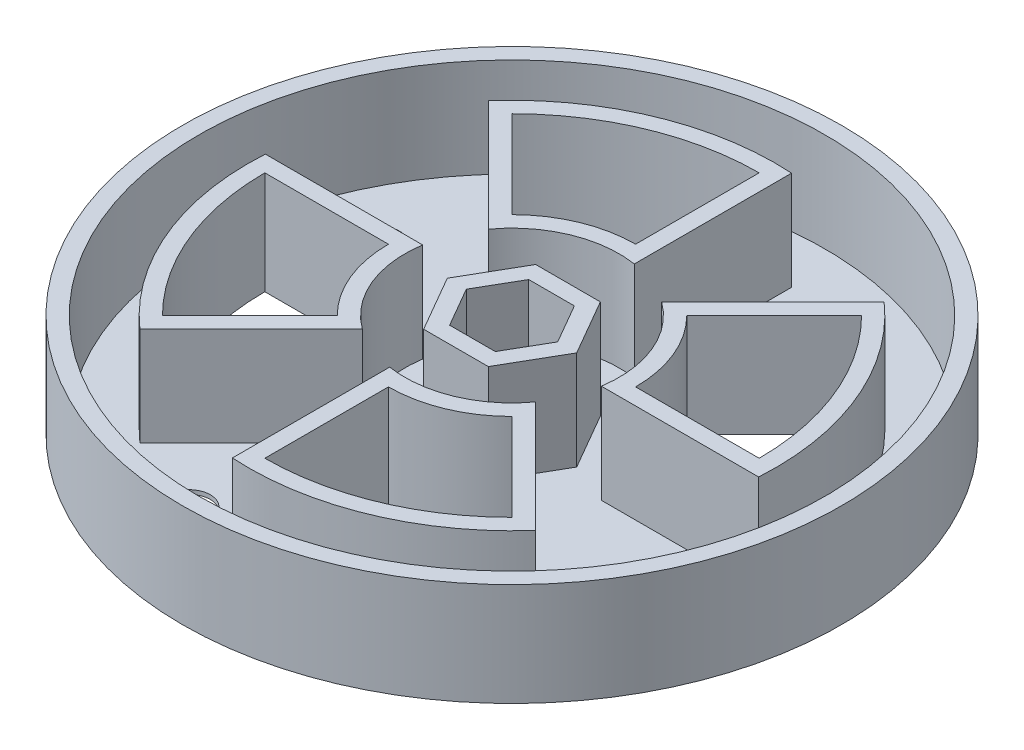
from build123d import *

# Parameters (mm, degrees)
SKETCH1_R           = 50.8
BOSS_EXTRUDE1_DEPTH = 15.875
CUT_EXTRUDE2_DEPTH  = 15.24
SKETCH5_R           = 4.191
CUT_EXTRUDE3_DEPTH  = 74.440708058
CUT_EXTRUDE4_DEPTH  = 74.575101937
SKETCH7_R           = 48.26
CUT_EXTRUDE5_DEPTH  = 15.24
SKETCH8_R           = 3.2639
CUT_EXTRUDE6_DEPTH  = 74.575101937


with BuildPart() as part:
    # Sketch1 → Boss-Extrude1 (new body)
    with BuildSketch(Plane(origin=(0, 0, 0), x_dir=(1, 0, 0), z_dir=(0, 1, 0))):
        with Locations(Location((0, 0, 0), (0, 0, 270))):
            Circle(SKETCH1_R)
    extrude(amount=BOSS_EXTRUDE1_DEPTH)

    # Sketch4 → Cut-Extrude2 (cut)
    with BuildSketch(Plane(origin=(0, 15.875, 0), x_dir=(1, 0, 0), z_dir=(0, 1, 0))):
        Polygon((-3.519527241, 6.096), (3.519527241, 6.096), (7.039054482, 0), (3.519527241, -6.096), (-3.519527241, -6.096), (-7.039054482, 0), align=None)
    extrude(amount=-CUT_EXTRUDE2_DEPTH, mode=Mode.SUBTRACT)

    # Sketch5 → Cut-Extrude3 (cut, through all)
    with BuildSketch(Plane(origin=(0, 0.635, 0), x_dir=(1, 0, 0), z_dir=(0, 1, 0))):
        with Locations(Location((0, 0, 0), (0, 0, 270))):
            Circle(SKETCH5_R)
    extrude(amount=-CUT_EXTRUDE3_DEPTH, mode=Mode.SUBTRACT)

    # Sketch6 → Cut-Extrude4 (cut, through all)
    with BuildSketch(Plane(origin=(0, 15.875, 0), x_dir=(1, 0, 0), z_dir=(0, 1, 0))):
        with BuildLine():
            ThreePointArc((-13.470384182, 13.470384182), (-7.290119387, 17.599905094), (0, 19.05))
            Line((0, 19.05), (0, 38.1))
            ThreePointArc((0, 38.1), (-14.580238773, 35.199810189), (-26.940768363, 26.940768363))
            Line((-26.940768363, 26.940768363), (-13.470384182, 13.470384182))
        make_face()
        with BuildLine():
            Line((26.940768363, 26.940768363), (13.470384182, 13.470384182))
            ThreePointArc((13.470384182, 13.470384182), (17.599905094, 7.290119387), (19.05, 0))
            Line((19.05, 0), (38.1, 0))
            ThreePointArc((38.1, 0), (35.199810189, 14.580238773), (26.940768363, 26.940768363))
        make_face()
        with BuildLine():
            Line((26.940768363, -26.940768363), (13.470384182, -13.470384182))
            ThreePointArc((13.470384182, -13.470384182), (7.290119387, -17.599905094), (0, -19.05))
            Line((0, -19.05), (0, -38.1))
            ThreePointArc((0, -38.1), (14.580238773, -35.199810189), (26.940768363, -26.940768363))
        make_face()
        with BuildLine():
            Line((-26.940768363, -26.940768363), (-13.470384182, -13.470384182))
            ThreePointArc((-13.470384182, -13.470384182), (-17.599905094, -7.290119387), (-19.05, 0))
            Line((-19.05, 0), (-38.1, 0))
            ThreePointArc((-38.1, 0), (-35.199810189, -14.580238773), (-26.940768363, -26.940768363))
        make_face()
    extrude(amount=-CUT_EXTRUDE4_DEPTH, mode=Mode.SUBTRACT)

    # Sketch7 → Cut-Extrude5 (cut)
    with BuildSketch(Plane(origin=(0, 15.875, 0), x_dir=(1, 0, 0), z_dir=(0, 1, 0))):
        with Locations(Location((0, 0, 0), (0, 0, 270))):
            Circle(SKETCH7_R)
        with BuildLine():
            Line((-16.313445375, 2.54), (-40.560547334, 2.54))
            ThreePointArc((-40.560547334, 2.54), (-37.546464201, -15.552254691), (-26.884586844, -30.476689292))
            Line((-26.884586844, -30.476689292), (-9.739296625, -13.331399073))
            ThreePointArc((-9.739296625, -13.331399073), (-15.253251082, -6.318103468), (-16.313445375, 2.54))
        make_face(mode=Mode.SUBTRACT)
        with BuildLine():
            Line((16.313445375, -2.54), (40.560547334, -2.54))
            ThreePointArc((40.560547334, -2.54), (37.546464201, 15.552254691), (26.884586844, 30.476689292))
            Line((26.884586844, 30.476689292), (9.739296625, 13.331399073))
            ThreePointArc((9.739296625, 13.331399073), (15.253251082, 6.318103468), (16.313445375, -2.54))
        make_face(mode=Mode.SUBTRACT)
        Polygon((4.985996925, 8.636), (-4.985996925, 8.636), (-9.971993849, 0), (-4.985996925, -8.636), (4.985996925, -8.636), (9.971993849, 0), align=None, mode=Mode.SUBTRACT)
        with BuildLine():
            ThreePointArc((2.54, 40.560547334), (-15.552254691, 37.546464201), (-30.476689292, 26.884586844))
            Line((-30.476689292, 26.884586844), (-13.331399073, 9.739296625))
            ThreePointArc((-13.331399073, 9.739296625), (-6.318103468, 15.253251082), (2.54, 16.313445375))
            Line((2.54, 16.313445375), (2.54, 40.560547334))
        make_face(mode=Mode.SUBTRACT)
        with BuildLine():
            Line((-2.54, -16.313445375), (-2.54, -40.560547334))
            ThreePointArc((-2.54, -40.560547334), (15.552254691, -37.546464201), (30.476689292, -26.884586844))
            Line((30.476689292, -26.884586844), (13.331399073, -9.739296625))
            ThreePointArc((13.331399073, -9.739296625), (6.318103468, -15.253251082), (-2.54, -16.313445375))
        make_face(mode=Mode.SUBTRACT)
    extrude(amount=-CUT_EXTRUDE5_DEPTH, mode=Mode.SUBTRACT)

    # Sketch8 → Cut-Extrude6 (cut, through all)
    with BuildSketch(Plane.XZ):
        with Locations(Location((-35.199810189, -14.580238773, 0), (0, 0, 270))):
            Circle(SKETCH8_R)
        with Locations(Location((35.199810189, 14.580238773, 0), (0, 0, 270))):
            Circle(SKETCH8_R)
        with Locations(Location((14.580238773, -35.199810189, 0), (0, 0, 270))):
            Circle(SKETCH8_R)
        with Locations(Location((-14.580238773, 35.199810189, 0), (0, 0, 270))):
            Circle(SKETCH8_R)
    extrude(amount=-CUT_EXTRUDE6_DEPTH, mode=Mode.SUBTRACT)


solid = part.part
